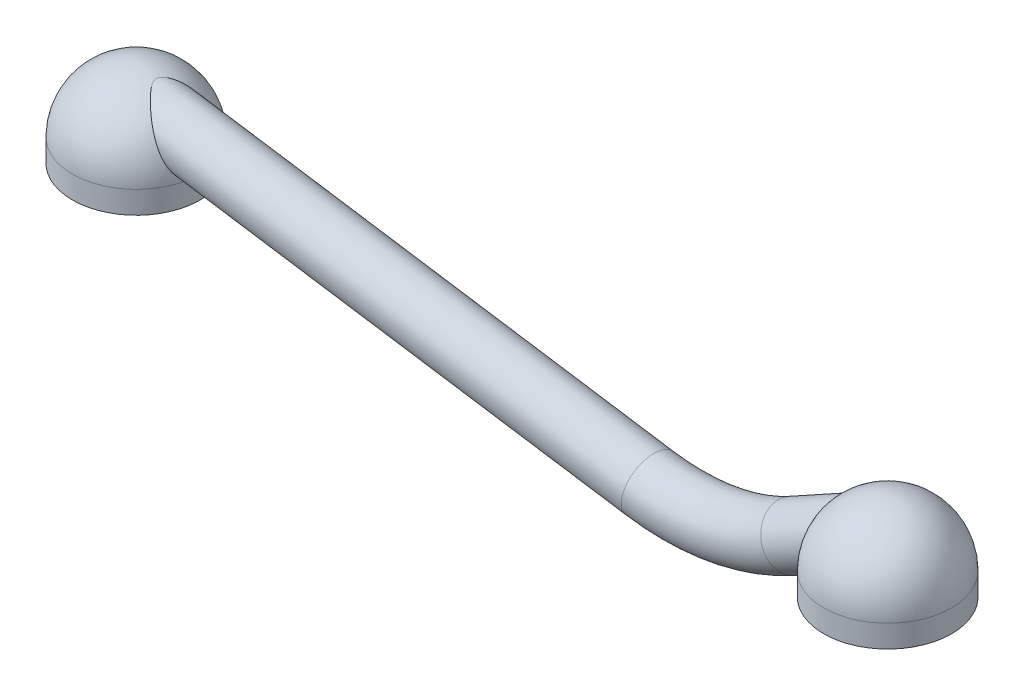
from build123d import *
from build123d.topology import SkipClean

# Parameters (mm, degrees)
SKETCH1_R             = 2.85
SKETCH1_R_2           = 1.9
BOSS_EXTRUDE1_DEPTH   = 1
BOSS_EXTRUDE1_2_DEPTH = 1
SKETCH6_R             = 1.25


with BuildPart() as part:
    # Sketch1 → Boss-Extrude1 (new body)
    with BuildSketch(Plane(origin=(0, 0, 0), x_dir=(1, 0, 0), z_dir=(0, 1, 0))):
        with Locations(Location((2.85, 0, 0), (0, 0, 270))):
            Circle(SKETCH1_R)
        with Locations(Location((2.85, 0, 0), (0, 0, 270))):
            Circle(SKETCH1_R_2, mode=Mode.SUBTRACT)
    extrude(amount=BOSS_EXTRUDE1_DEPTH)

    # Sketch2 → Revolve1 (revolve)
    with BuildSketch(Plane.XY):
        with BuildLine():
            Line((0.95, 1), (0, 1))
            ThreePointArc((0, 1), (0.834745674, 3.015254326), (2.85, 3.85))
            Line((2.85, 3.85), (2.85, 2.9))
            ThreePointArc((2.85, 2.9), (1.506497116, 2.343502884), (0.95, 1))
        make_face()
    revolve(axis=Axis((2.85, 3.85, 0), (0, -1, 0)))



with BuildPart() as body_2:
    # Sketch1 → Boss-Extrude1 2 (new body)
    with BuildSketch(Plane(origin=(0, 0, 0), x_dir=(1, 0, 0), z_dir=(0, 1, 0))):
        with Locations(Location((36.35, 0, 0), (0, 0, 270))):
            Circle(SKETCH1_R)
        with Locations(Location((36.35, 0, 0), (0, 0, 270))):
            Circle(SKETCH1_R_2, mode=Mode.SUBTRACT)
    extrude(amount=BOSS_EXTRUDE1_2_DEPTH)

    # Sketch3 → Revolve2 (revolve)
    with BuildSketch(Plane.XY):
        with BuildLine():
            Line((34.45, 1), (33.5, 1))
            ThreePointArc((33.5, 1), (34.334745674, 3.015254326), (36.35, 3.85))
            Line((36.35, 3.85), (36.35, 2.9))
            ThreePointArc((36.35, 2.9), (35.006497116, 2.343502884), (34.45, 1))
        make_face()
    revolve(axis=Axis((36.35, 3.85, 0), (0, -1, 0)))


with BuildPart() as part_1:
    add(part.part)

    add(body_2.part)  # Sweep2 merges body 2
    # Sweep2: sweep along a path in Sketch4
    with BuildLine(Plane.XY) as sweep2_path:
        Line((2.857791508, 2.577073997), (25.735308166, -0.910058828))
        ThreePointArc((25.735308166, -0.910058828), (29.000921957, -0.868365637), (32.078947298, 0.223299034))
        Line((32.078947298, 0.223299034), (36.338250501, 2.577073997))
    # Sketch6 → Sweep2 (sweep)
    with BuildSketch(Plane(origin=(2.857791508, 2.577073997, 0), x_dir=(0, 0, -1), z_dir=(0.9885817138183747, -0.1506857495051383, 0))):
        Circle(SKETCH6_R)
    sweep(path=sweep2_path.line)

    # Sketch2<3> → Cut-Revolve2 (revolve, cut)
    with BuildSketch(Plane.XY, mode=Mode.PRIVATE) as cut_revolve2_sk:
        with BuildLine():
            ThreePointArc((0.95, 1), (1.506497116, 2.343502884), (2.85, 2.9))
            Line((2.85, 2.9), (2.85, 0))
            Line((2.85, 0), (0.95, 0))
            Line((0.95, 0), (0.95, 1))
        make_face()
    revolve(cut_revolve2_sk.sketch.rotate(Axis((2.85, 2.9, 0), (0, -1, 0)), 169.541612369), axis=Axis((2.85, 2.9, 0), (0, -1, 0)), mode=Mode.SUBTRACT)

    # Sketch3<3> → Cut-Revolve3 (revolve, cut)
    with SkipClean():  # the faces are left unmerged after this step: merging them gives an invalid solid
        with BuildSketch(Plane.XY):
            with BuildLine():
                ThreePointArc((34.45, 1), (35.006497116, 2.343502884), (36.35, 2.9))
                Line((36.35, 2.9), (36.35, 0))
                Line((36.35, 0), (34.45, 0))
                Line((34.45, 0), (34.45, 1))
            make_face()
        revolve(axis=Axis((36.35, 2.9, 0), (0, -1, 0)), mode=Mode.SUBTRACT)


solid = part_1.part
